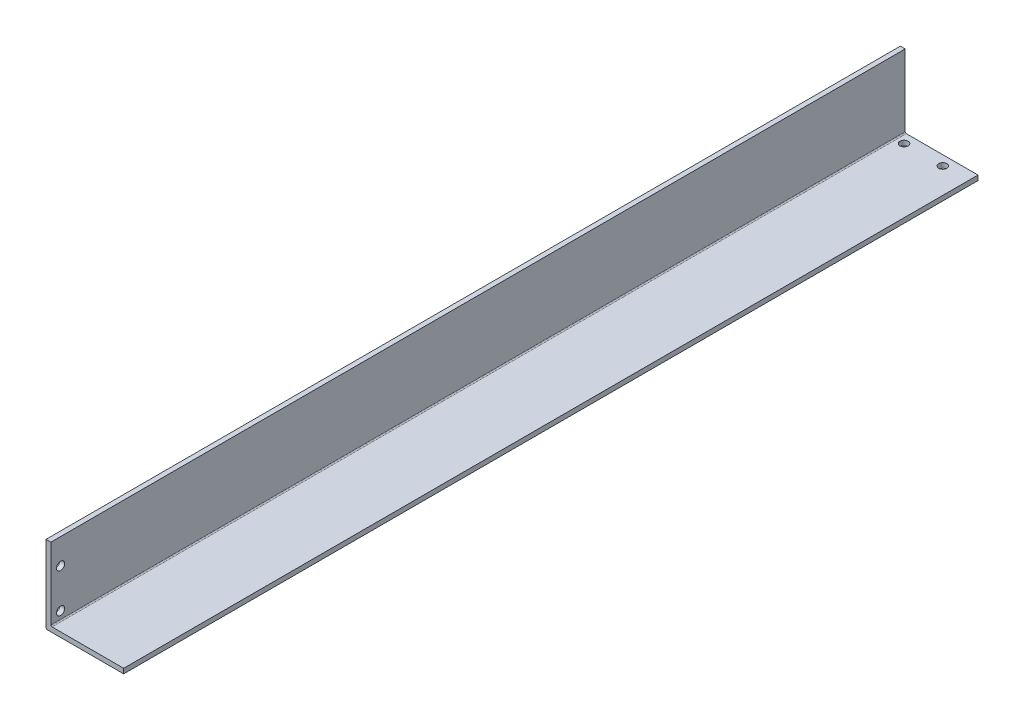
from build123d import *

# Parameters (mm, degrees)
BOSS_EXTRUDE1_DEPTH = 558.8
SKETCH2_R           = 2.667
CUT_EXTRUDE1_DEPTH  = 564.121852377
SKETCH3_R           = 2.667
CUT_EXTRUDE2_DEPTH  = 564.121852377


with BuildPart() as part:
    # Sketch1 → Boss-Extrude1 (new body)
    with BuildSketch(Plane.XY):
        with BuildLine():
            Line((3.175, 50.8), (3.175, 3.937))
            ThreePointArc((3.175, 3.937), (3.398184633, 3.398184633), (3.937, 3.175))
            Line((3.937, 3.175), (50.8, 3.175))
            Line((50.8, 3.175), (50.8, 0))
            Line((50.8, 0), (0.762, 0))
            ThreePointArc((0.762, 0), (0.223184633, 0.223184633), (0, 0.762))
            Line((0, 0.762), (0, 50.8))
            Line((0, 50.8), (3.175, 50.8))
        make_face()
    extrude(amount=BOSS_EXTRUDE1_DEPTH)

    # Sketch2 → Cut-Extrude1 (cut, through all)
    with BuildSketch(Plane(origin=(0, 3.175, 0), x_dir=(1, 0, 0), z_dir=(0, 1, 0))):
        with Locations(Location((34.163, -6.35, 0), (0, 0, 270))):
            Circle(SKETCH2_R)
        with Locations(Location((8.763, -6.35, 0), (0, 0, 270))):
            Circle(SKETCH2_R)
    extrude(amount=-CUT_EXTRUDE1_DEPTH, mode=Mode.SUBTRACT)

    # Sketch3 → Cut-Extrude2 (cut, through all)
    with BuildSketch(Plane(origin=(3.175, 0, 0), x_dir=(0, 0, -1), z_dir=(1, 0, 0))):
        with Locations(Location((-552.45, 34.163, 0), (0, 0, 90))):
            Circle(SKETCH3_R)
        with Locations(Location((-552.45, 8.763, 0), (0, 0, 90))):
            Circle(SKETCH3_R)
    extrude(amount=-CUT_EXTRUDE2_DEPTH, mode=Mode.SUBTRACT)


solid = part.part
